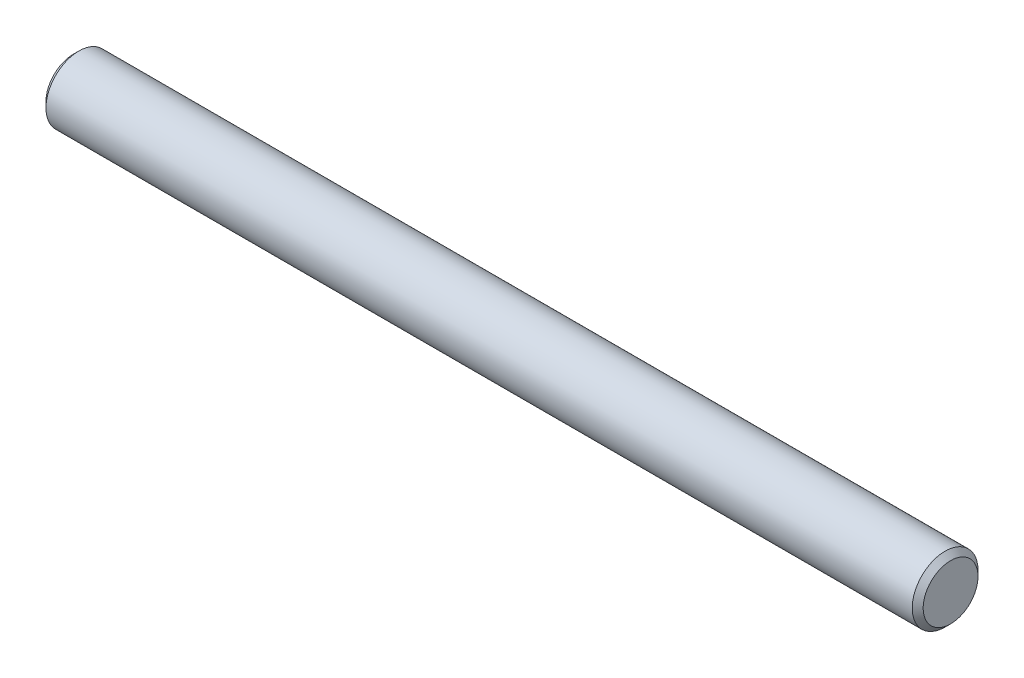
from build123d import *

# Parameters (mm, degrees)
SKETCH1_R           = 1.5
BOSS_EXTRUDE1_DEPTH = 20
CHAMFER1_SIZE       = 0.25


with BuildPart() as part:
    # Sketch1 → Boss-Extrude1 (new, symmetric)
    with BuildSketch(Plane(origin=(0, 0, 0), x_dir=(0, 0, -1), z_dir=(1, 0, 0))):
        Circle(SKETCH1_R)
    extrude(amount=BOSS_EXTRUDE1_DEPTH, both=True)

    # Chamfer1
    chamfer1_edges = [part.edges().sort_by_distance(p)[0] for p in [
        (-20, 0, 1.5),
        (20, 0, 1.5),
    ]]
    chamfer(chamfer1_edges, length=CHAMFER1_SIZE)


solid = part.part
